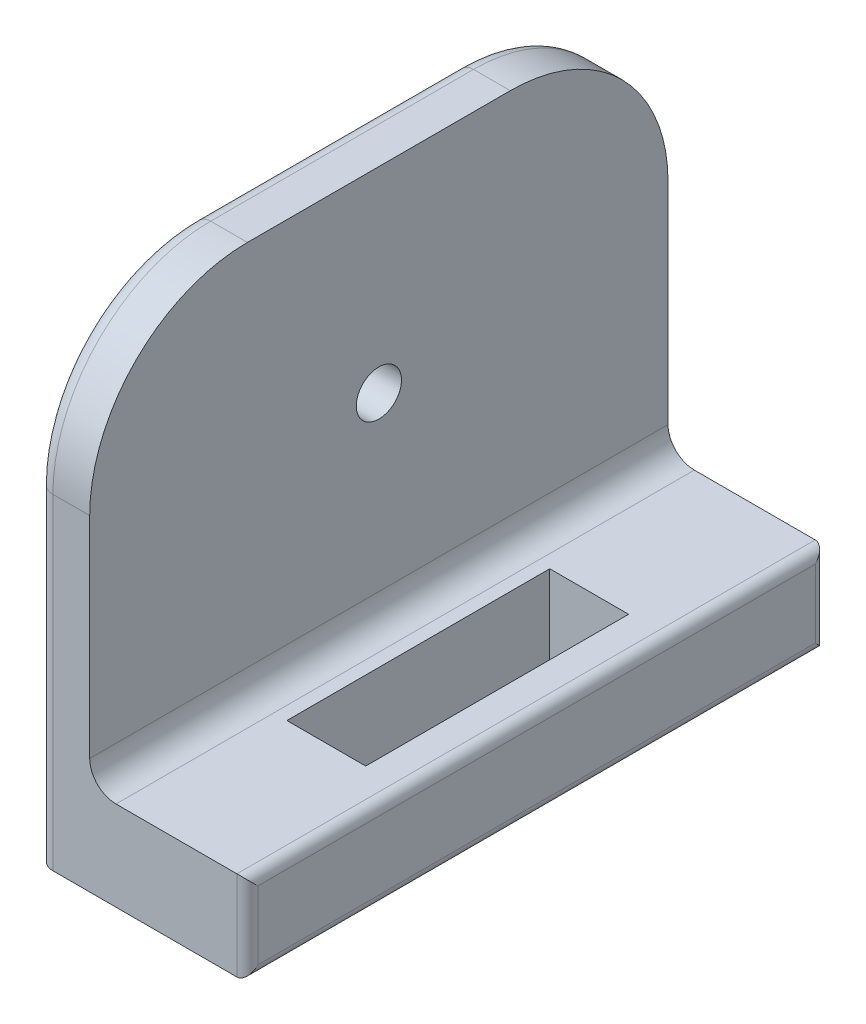
from build123d import *

# Parameters (mm, degrees)
SKETCH1_W           = 40
SKETCH1_H           = 110
BOSS_EXTRUDE1_DEPTH = 17
SKETCH4_W           = 110
SKETCH4_H           = 75
BOSS_EXTRUDE2_DEPTH = 10
SKETCH5_W           = 15
SKETCH5_H           = 50
CUT_EXTRUDE1_DEPTH  = 17
SKETCH6_R           = 4.3
CUT_EXTRUDE2_DEPTH  = 10
FILLET1_R           = 30
FILLET2_R           = 3
FILLET3_R           = 5
FILLET4_R           = 2


with BuildPart() as part:
    # Sketch1 → Boss-Extrude1 (new body)
    with BuildSketch(Plane(origin=(0, 0, 0), x_dir=(1, 0, 0), z_dir=(0, 1, 0))):
        with Locations((20, 55)):
            Rectangle(SKETCH1_W, SKETCH1_H)
    extrude(amount=BOSS_EXTRUDE1_DEPTH)

    # Sketch4 → Boss-Extrude2 (add)
    with BuildSketch(Plane(origin=(0, 0, 0), x_dir=(0, 0, -1), z_dir=(1, 0, 0))):
        with Locations((55, 54.5)):
            Rectangle(SKETCH4_W, SKETCH4_H)
    extrude(amount=BOSS_EXTRUDE2_DEPTH)

    # Sketch5 → Cut-Extrude1 (cut)
    with BuildSketch(Plane(origin=(0, 17, 0), x_dir=(1, 0, 0), z_dir=(0, 1, 0))):
        with Locations((25, 55)):
            Rectangle(SKETCH5_W, SKETCH5_H)
    extrude(amount=-CUT_EXTRUDE1_DEPTH, mode=Mode.SUBTRACT)

    # Sketch6 → Cut-Extrude2 (cut)
    with BuildSketch(Plane(origin=(10, 0, 0), x_dir=(0, 0, -1), z_dir=(1, 0, 0))):
        with Locations((55, 54.7)):
            Circle(SKETCH6_R)
    extrude(amount=-CUT_EXTRUDE2_DEPTH, mode=Mode.SUBTRACT)

    # Fillet1
    fillet1_edges = [part.edges().sort_by_distance(p)[0] for p in [
        (5, 92, 0),
        (5, 92, -110),
    ]]
    fillet(fillet1_edges, radius=FILLET1_R)

    # Fillet2
    fillet2_edges = [part.edges().sort_by_distance(p)[0] for p in [
        (0, 31, 0),
        (0, 92, -55),
        (0, 31, -110),
        (0, 83.213203436, -101.213203436),
        (0, 83.213203436, -8.786796564),
    ]]
    fillet(fillet2_edges, radius=FILLET2_R)

    # Fillet3
    fillet3_edges = [part.edges().sort_by_distance(p)[0] for p in [
        (10, 17, -55),
    ]]
    fillet(fillet3_edges, radius=FILLET3_R)

    # Fillet4
    fillet4_edges = [part.edges().sort_by_distance(p)[0] for p in [
        (40, 17, -55),
        (40, 0, -55),
        (40, 8.5, -110),
        (40, 8.5, 0),
    ]]
    fillet(fillet4_edges, radius=FILLET4_R)


solid = part.part
